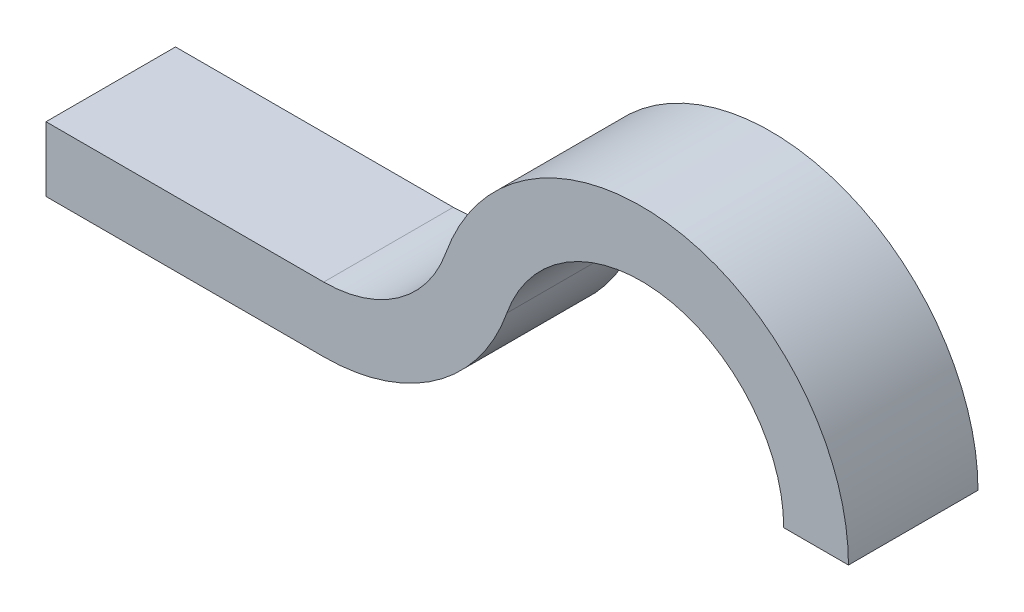
from build123d import *

# Parameters (mm, degrees)
BASE_EXTRUDE_DEPTH = 10


with BuildPart() as part:
    # Sketch1 → Base-Extrude (new body)
    with BuildSketch(Plane.XY):
        with BuildLine():
            Line((-24.513035081, -6.333333333), (-45.95357014, -6.333333333))
            Line((-45.95357014, -6.333333333), (-45.95357014, -1.333333333))
            Line((-45.95357014, -1.333333333), (-24.513035081, -1.333333333))
            ThreePointArc((-24.513035081, -1.333333333), (-18.739532389, 0.501700857), (-15.084944665, 5.333333333))
            ThreePointArc((-15.084944665, 5.333333333), (2.70563166, 15.769576954), (16, 0))
            Line((16, 0), (11, 0))
            ThreePointArc((11, 0), (1.860121766, 10.841584156), (-10.370899457, 3.666666667))
            ThreePointArc((-10.370899457, 3.666666667), (-15.852781043, -3.580782047), (-24.513035081, -6.333333333))
        make_face()
    extrude(amount=BASE_EXTRUDE_DEPTH)


solid = part.part
